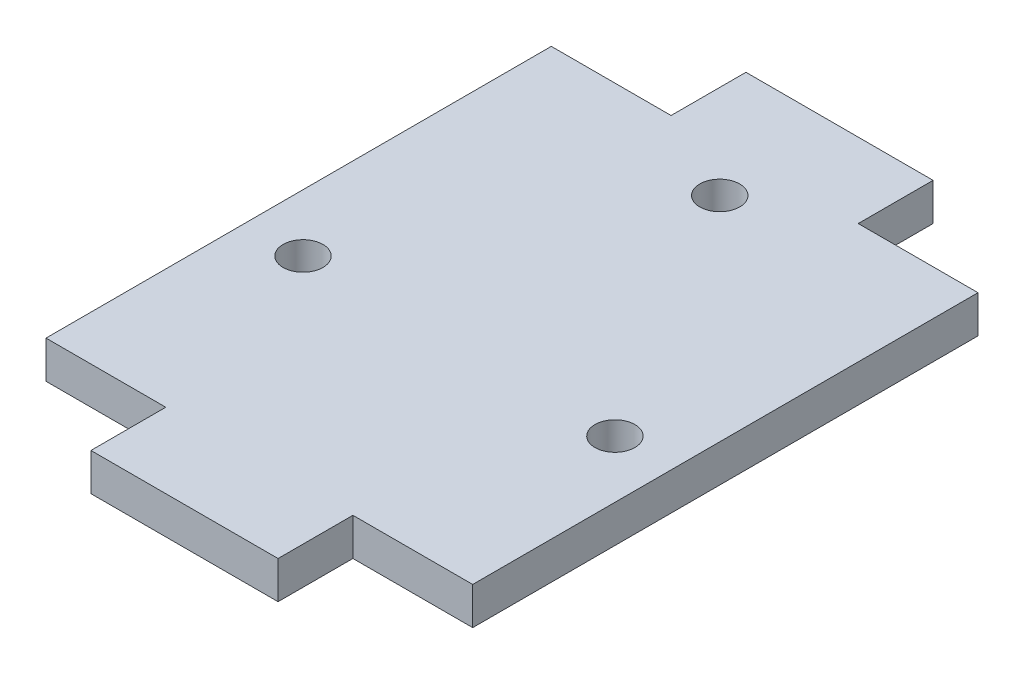
from build123d import *

# Parameters (mm, degrees)
ESBO_O1_R                = 1.6
RESSALTO_EXTRUS_O1_DEPTH = 3


with BuildPart() as part:
    # Esboço1 → Ressalto-extrusão1 (new body)
    with BuildSketch(Plane.XZ.offset(6)):
        Polygon((17.1, 36.9), (7.5, 36.9), (7.5, 42.9), (-7.5, 42.9), (-7.5, 36.9), (-17.1, 36.9), (-17.1, -3.6), (-7.5, -3.6), (-7.5, -9.6), (7.5, -9.6), (7.5, -3.6), (17.1, -3.6), align=None)
        with Locations(Location((-12.5, 20.9, 0), (0, 0, 90))):
            Circle(ESBO_O1_R, mode=Mode.SUBTRACT)
        with Locations(Location((0, 0, 0), (0, 0, 90))):
            Circle(ESBO_O1_R, mode=Mode.SUBTRACT)
        with Locations(Location((12.5, 20.9, 0), (0, 0, 90))):
            Circle(ESBO_O1_R, mode=Mode.SUBTRACT)
    extrude(amount=-RESSALTO_EXTRUS_O1_DEPTH)


solid = part.part
